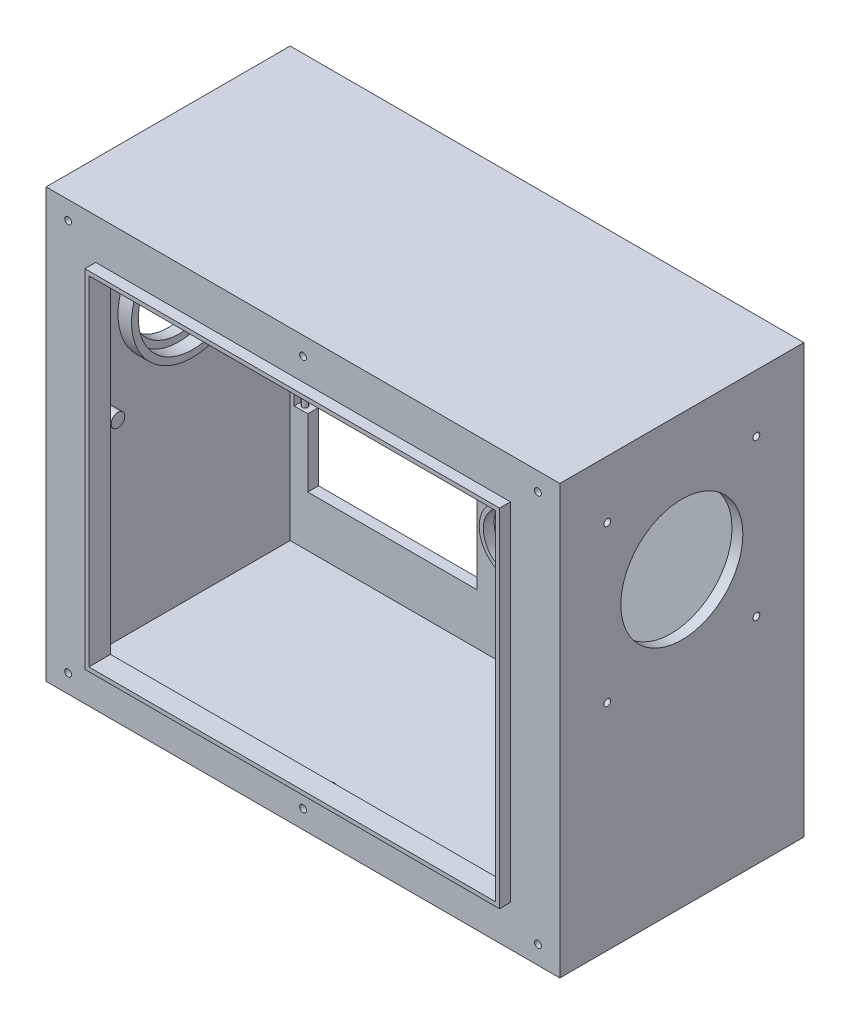
from build123d import *

# Parameters (mm, degrees)
CROQUIS1_W                     = 379
CROQUIS1_H                     = 316
SALIENTE_EXTRUIR1_DEPTH        = 180
VACIADO1_T                     = -8
CROQUIS2_R                     = 35
CORTAR_EXTRUIR4_DEPTH          = 20
CROQUIS4_R                     = 45
CROQUIS4_R_2                   = 40
SALIENTE_EXTRUIR4_DEPTH        = 10
CORTAR_EXTRUIR6_START          = -10
CROQUIS6_R                     = 45
CORTAR_EXTRUIR6_DEPTH          = 10
CROQUIS7_R                     = 24
CROQUIS7_R_2                   = 21
SALIENTE_EXTRUIR9_DEPTH        = 18
CROQUIS11_W                    = 363
CROQUIS11_H                    = 300
CROQUIS11_W_2                  = 300
CROQUIS11_H_2                  = 250
SALIENTE_EXTRUIR10_DEPTH       = 8
CROQUIS12_W                    = 306
CROQUIS12_H                    = 256
CROQUIS12_W_2                  = 300
CROQUIS12_H_2                  = 250
SALIENTE_EXTRUIR11_DEPTH       = 8
CROQUIS20_R                    = 21
CROQUIS20_R_2                  = 18.5
SALIENTE_EXTRUIR19_DEPTH       = 10
CROQUIS32_R                    = 5
SALIENTE_EXTRUIR22_DEPTH       = 10
TALADRO_ROSCADO_M63_AT_2_COUNT = 2
TALADRO_ROSCADO_M63_AT_2_PITCH = 110
TALADRO_ROSCADO_M63_AT_3_COUNT = 2
TALADRO_ROSCADO_M63_AT_3_PITCH = 159.138304628
TALADRO_ROSCADO_M63_AT_4_COUNT = 2
TALADRO_ROSCADO_M63_AT_4_PITCH = 115
CROQUIS28_W                    = 125
CROQUIS28_H                    = 225
CORTAR_EXTRUIR7_DEPTH          = 8
CROQUIS29_W                    = 10
CROQUIS29_H                    = 20
CORTAR_EXTRUIR9_DEPTH          = 8
CROQUIS30_R                    = 2
SALIENTE_EXTRUIR20_DEPTH       = 9
CROQUIS31_R                    = 2
SALIENTE_EXTRUIR21_DEPTH       = 9
SALIENTE_EXTRUIR23_START       = -8
CROQUIS33_R                    = 5
SALIENTE_EXTRUIR23_DEPTH       = 15
TALADRO_ROSCADO_M64_D          = 5
TALADRO_ROSCADO_M64_DEPTH      = 17
TALADRO_ROSCADO_M64_TIP        = 1.502151548


with BuildPart() as part:
    # Croquis1 → Saliente-Extruir1 (new body)
    with BuildSketch(Plane.XY):
        Rectangle(CROQUIS1_W, CROQUIS1_H)
    extrude(amount=SALIENTE_EXTRUIR1_DEPTH)

    # Vaciado1
    vaciado1_openings = [part.faces().sort_by_distance(p)[0] for p in [
        (0, 0, 180),
    ]]
    offset(amount=VACIADO1_T, openings=vaciado1_openings, kind=Kind.INTERSECTION)

    # Croquis2 → Cortar-Extruir4 (cut)
    with BuildSketch(Plane.ZY.offset(189.5)):
        with Locations((90, 58)):
            Circle(CROQUIS2_R)
    extrude(amount=-CORTAR_EXTRUIR4_DEPTH, mode=Mode.SUBTRACT)

    # Croquis4 → Saliente-Extruir4 (add)
    with BuildSketch(Plane(origin=(-181.5, 0, 0), x_dir=(0, 0, -1), z_dir=(1, 0, 0))):
        with Locations((-90, 58)):
            Circle(CROQUIS4_R)
        with Locations((-90, 58)):
            Circle(CROQUIS4_R_2, mode=Mode.SUBTRACT)
    extrude(amount=SALIENTE_EXTRUIR4_DEPTH)

    # Croquis6 → Cortar-Extruir6 (cut)
    with BuildSketch(Plane(origin=(189.5, 0, 0), x_dir=(0, 0, -1), z_dir=(1, 0, 0)).offset(CORTAR_EXTRUIR6_START)):
        with Locations((-90, 58)):
            Circle(CROQUIS6_R)
    extrude(amount=CORTAR_EXTRUIR6_DEPTH, mode=Mode.SUBTRACT)

    # Croquis7 → Saliente-Extruir9 (add)
    with BuildSketch(Plane.XY.offset(8)):
        with Locations(Location((0, -53, 0), (0, 0, 180))):
            Circle(CROQUIS7_R)
        with Locations((0, -53)):
            Circle(CROQUIS7_R_2, mode=Mode.SUBTRACT)
    extrude(amount=SALIENTE_EXTRUIR9_DEPTH)

    # Croquis11 → Saliente-Extruir10 (add)
    with BuildSketch(Plane.XY.offset(180)):
        Rectangle(CROQUIS11_W, CROQUIS11_H)
        Rectangle(CROQUIS11_W_2, CROQUIS11_H_2, mode=Mode.SUBTRACT)
    extrude(amount=-SALIENTE_EXTRUIR10_DEPTH)

    # Croquis12 → Saliente-Extruir11 (add)
    with BuildSketch(Plane.XY.offset(180)):
        Rectangle(CROQUIS12_W, CROQUIS12_H)
        Rectangle(CROQUIS12_W_2, CROQUIS12_H_2, mode=Mode.SUBTRACT)
    extrude(amount=SALIENTE_EXTRUIR11_DEPTH)

    # Croquis20 → Saliente-Extruir19 (add)
    with BuildSketch(Plane.XY.offset(8)):
        with Locations((0, -53)):
            Circle(CROQUIS20_R)
        with Locations((0, -53)):
            Circle(CROQUIS20_R_2, mode=Mode.SUBTRACT)
    extrude(amount=SALIENTE_EXTRUIR19_DEPTH)

    # Croquis32 → Saliente-Extruir22 (add)
    with BuildSketch(Plane(origin=(-181.5, 0, 0), x_dir=(0, 0, -1), z_dir=(1, 0, 0))):
        with Locations((-35, 115.5)):
            Circle(CROQUIS32_R)
        with Locations((-145, 115.5)):
            Circle(CROQUIS32_R)
        with Locations((-145, 0.5)):
            Circle(CROQUIS32_R)
        with Locations((-35, 0.5)):
            Circle(CROQUIS32_R)
    saliente_extruir22 = extrude(amount=SALIENTE_EXTRUIR22_DEPTH)

    # Croquis26 → Taladro roscado M63 (revolve, cut)
    with BuildSketch(Plane(origin=(-189.5, 115.5, 35), x_dir=(0, 0, 1), z_dir=(0, 1, 0))):
        Polygon((0, 0), (0, 15.502151548), (2.5, 14), (2.5, 0), align=None)
    taladro_roscado_m63 = revolve(axis=Axis((-195.85, 115.5, 35), (1, 0, 0)), mode=Mode.SUBTRACT)

    # Taladro roscado M63 at 2: Taladro roscado M63 ×2
    with Locations(*[(0, 0, i * TALADRO_ROSCADO_M63_AT_2_PITCH) for i in range(1, TALADRO_ROSCADO_M63_AT_2_COUNT)]):
        add(taladro_roscado_m63, mode=Mode.SUBTRACT)

    # Taladro roscado M63 at 3: Taladro roscado M63 ×2
    with Locations(*[Vector(0, -0.7226418571476992, 0.6912226459673645) * (i * TALADRO_ROSCADO_M63_AT_3_PITCH) for i in range(1, TALADRO_ROSCADO_M63_AT_3_COUNT)]):
        add(taladro_roscado_m63, mode=Mode.SUBTRACT)

    # Taladro roscado M63 at 4: Taladro roscado M63 ×2
    with Locations(*[(0, -i * TALADRO_ROSCADO_M63_AT_4_PITCH, 0) for i in range(1, TALADRO_ROSCADO_M63_AT_4_COUNT)]):
        add(taladro_roscado_m63, mode=Mode.SUBTRACT)

    # Croquis28 → Cortar-Extruir7 (cut)
    with BuildSketch(Plane(origin=(0, 0, 0), x_dir=(-1, 0, 0), z_dir=(0, 0, -1))):
        with Locations((106, 0)):
            Rectangle(CROQUIS28_W, CROQUIS28_H)
    extrude(amount=-CORTAR_EXTRUIR7_DEPTH, mode=Mode.SUBTRACT)

    # Croquis29 → Cortar-Extruir9 (cut)
    with BuildSketch(Plane(origin=(0, 0, 0), x_dir=(-1, 0, 0), z_dir=(0, 0, -1))):
        with Locations((173.5, 52.5)):
            Rectangle(CROQUIS29_W, CROQUIS29_H)
        with Locations((173.5, -52.5)):
            Rectangle(CROQUIS29_W, CROQUIS29_H)
    extrude(amount=-CORTAR_EXTRUIR9_DEPTH, mode=Mode.SUBTRACT)

    # Croquis30 → Saliente-Extruir20 (add)
    with BuildSketch(Plane(origin=(0, 42.5, 0), x_dir=(1, 0, 0), z_dir=(0, 1, 0))):
        with Locations(Location((-174.5, -4, 0), (0, 0, 90))):
            Circle(CROQUIS30_R)
    extrude(amount=SALIENTE_EXTRUIR20_DEPTH)

    # Croquis31 → Saliente-Extruir21 (add)
    with BuildSketch(Plane(origin=(0, -62.5, 0), x_dir=(1, 0, 0), z_dir=(0, 1, 0))):
        with Locations(Location((-174.5, -4, 0), (0, 0, 90))):
            Circle(CROQUIS31_R)
    extrude(amount=SALIENTE_EXTRUIR21_DEPTH)

    # Simetría1: Saliente-Extruir22 across plane
    add(saliente_extruir22.mirror(Plane(origin=(0, 0, 0), x_dir=(0, 0, 1), z_dir=(1, 0, 0))))

    # Croquis33 → Saliente-Extruir23 (add)
    with BuildSketch(Plane.XY.offset(180).offset(SALIENTE_EXTRUIR23_START)):
        with Locations(Location((0, 144.5, 0), (0, 0, 180))):
            Circle(CROQUIS33_R)
        with Locations(Location((0, -144.5, 0), (0, 0, 180))):
            Circle(CROQUIS33_R)
        with Locations(Location((173.308544304, -144.5, 0), (0, 0, 180))):
            Circle(CROQUIS33_R)
        with Locations(Location((173.308544304, 144.5, 0), (0, 0, 180))):
            Circle(CROQUIS33_R)
        with Locations(Location((-173.308544304, 144.5, 0), (0, 0, 180))):
            Circle(CROQUIS33_R)
        with Locations(Location((-173.308544304, -144.5, 0), (0, 0, 180))):
            Circle(CROQUIS33_R)
    extrude(amount=-SALIENTE_EXTRUIR23_DEPTH)

    # Taladro roscado M64
    with Locations(Plane(origin=(-173.308544304, 144.5, 180), x_dir=(1, 0, 0), z_dir=(0, 0, 1))):
        with Locations((0, 0), (173.308544304, 0), (346.617088608, 0), (346.617088608, -289), (173.308544304, -289), (0, -289)):
            Hole(TALADRO_ROSCADO_M64_D / 2, depth=TALADRO_ROSCADO_M64_DEPTH)
            with Locations((0, 0, -(TALADRO_ROSCADO_M64_DEPTH + TALADRO_ROSCADO_M64_TIP / 2))):  # 118° drill point
                Cone(0, TALADRO_ROSCADO_M64_D / 2, TALADRO_ROSCADO_M64_TIP, mode=Mode.SUBTRACT)

    # Simetría2: Taladro roscado M63 across plane
    add(taladro_roscado_m63.mirror(Plane(origin=(0, 0, 0), x_dir=(0, 0, 1), z_dir=(1, 0, 0))), mode=Mode.SUBTRACT)

    # Simetría2 copy 1 sketch → Simetría2 copy 1 (revolve, cut)
    with BuildSketch(Plane(origin=(189.5, 115.5, 145), x_dir=(0, 0, 1), z_dir=(0, 1, 0))):
        Polygon((0, 0), (0, -15.502151548), (2.5, -14), (2.5, 0), align=None)
    revolve(axis=Axis((195.85, 115.5, 145), (1, 0, 0)), mode=Mode.SUBTRACT)

    # Simetría2 copy 2 sketch → Simetría2 copy 2 (revolve, cut)
    with BuildSketch(Plane(origin=(189.5, 0.5, 145), x_dir=(0, 0, 1), z_dir=(0, 1, 0))):
        Polygon((0, 0), (0, -15.502151548), (2.5, -14), (2.5, 0), align=None)
    revolve(axis=Axis((195.85, 0.5, 145), (1, 0, 0)), mode=Mode.SUBTRACT)

    # Simetría2 copy 3 sketch → Simetría2 copy 3 (revolve, cut)
    with BuildSketch(Plane(origin=(189.5, 0.5, 35), x_dir=(0, 0, 1), z_dir=(0, 1, 0))):
        Polygon((0, 0), (0, -15.502151548), (2.5, -14), (2.5, 0), align=None)
    revolve(axis=Axis((195.85, 0.5, 35), (1, 0, 0)), mode=Mode.SUBTRACT)


solid = part.part
